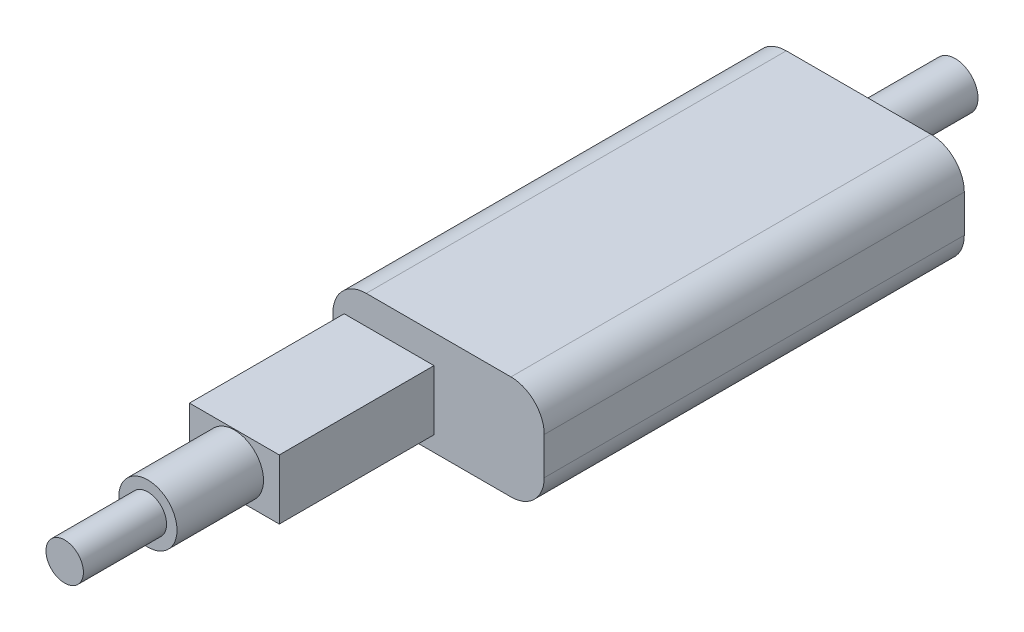
from build123d import *

# Parameters (mm, degrees)
ESQUISSE1_W        = 25.4
ESQUISSE1_H        = 12.5
BOSS_EXTRU_1_DEPTH = 25.25
CONG_1_R           = 4
ESQUISSE2_W        = 6.9
ESQUISSE2_H        = 1.9
BOSS_EXTRU_2_DEPTH = 1.5
ESQUISSE3_W        = 10.8
ESQUISSE3_H        = 7.2
BOSS_EXTRU_3_DEPTH = 18.6
ESQUISSE4_R        = 3.5
BOSS_EXTRU_4_DEPTH = 10.4
ESQUISSE5_R        = 2.25
BOSS_EXTRU_5_DEPTH = 10
ESQUISSE7_W        = 15
ESQUISSE7_H        = 5.6
BOSS_EXTRU_7_DEPTH = 1.6
ESQUISSE6_R        = 2.75
BOSS_EXTRU_6_DEPTH = 10


with BuildPart() as part:
    # Esquisse1 → Boss.-Extru.1 (new, symmetric)
    with BuildSketch(Plane.XY):
        Rectangle(ESQUISSE1_W, ESQUISSE1_H)
    extrude(amount=BOSS_EXTRU_1_DEPTH, both=True)

    # Congé1
    cong_1_edges = [part.edges().sort_by_distance(p)[0] for p in [
        (-12.7, 6.25, 0),
        (12.7, 6.25, 0),
        (12.7, -6.25, 0),
        (-12.7, -6.25, 0),
    ]]
    fillet(cong_1_edges, radius=CONG_1_R)

    # Esquisse2 → Boss.-Extru.2 (add)
    with BuildSketch(Plane.XY.offset(25.25)):
        with Locations((-4.45, 0.7)):
            Rectangle(ESQUISSE2_W, ESQUISSE2_H)
    extrude(amount=BOSS_EXTRU_2_DEPTH)

    # Esquisse3 → Boss.-Extru.3 (add)
    with BuildSketch(Plane.XY.offset(26.75)):
        with Locations((-4.45, 0.7)):
            Rectangle(ESQUISSE3_W, ESQUISSE3_H)
    extrude(amount=BOSS_EXTRU_3_DEPTH)

    # Esquisse4 → Boss.-Extru.4 (add)
    with BuildSketch(Plane.XY.offset(45.35)):
        with Locations((-4.45, 0.7)):
            Circle(ESQUISSE4_R)
    extrude(amount=BOSS_EXTRU_4_DEPTH)

    # Esquisse5 → Boss.-Extru.5 (add)
    with BuildSketch(Plane.XY.offset(55.75)):
        with Locations((-4.45, 0.7)):
            Circle(ESQUISSE5_R)
    extrude(amount=BOSS_EXTRU_5_DEPTH)

    # Esquisse7 → Boss.-Extru.7 (add)
    with BuildSketch(Plane(origin=(0, 0, -25.25), x_dir=(-1, 0, 0), z_dir=(0, 0, -1))):
        with Locations((0, 0.95)):
            Rectangle(ESQUISSE7_W, ESQUISSE7_H)
    extrude(amount=BOSS_EXTRU_7_DEPTH)

    # Esquisse6 → Boss.-Extru.6 (add)
    with BuildSketch(Plane(origin=(0, 0, -26.85), x_dir=(-1, 0, 0), z_dir=(0, 0, -1))):
        with Locations(Location((0, 1.25, 0), (0, 0, 114.619977329))):
            Circle(ESQUISSE6_R)
    extrude(amount=BOSS_EXTRU_6_DEPTH)


solid = part.part
